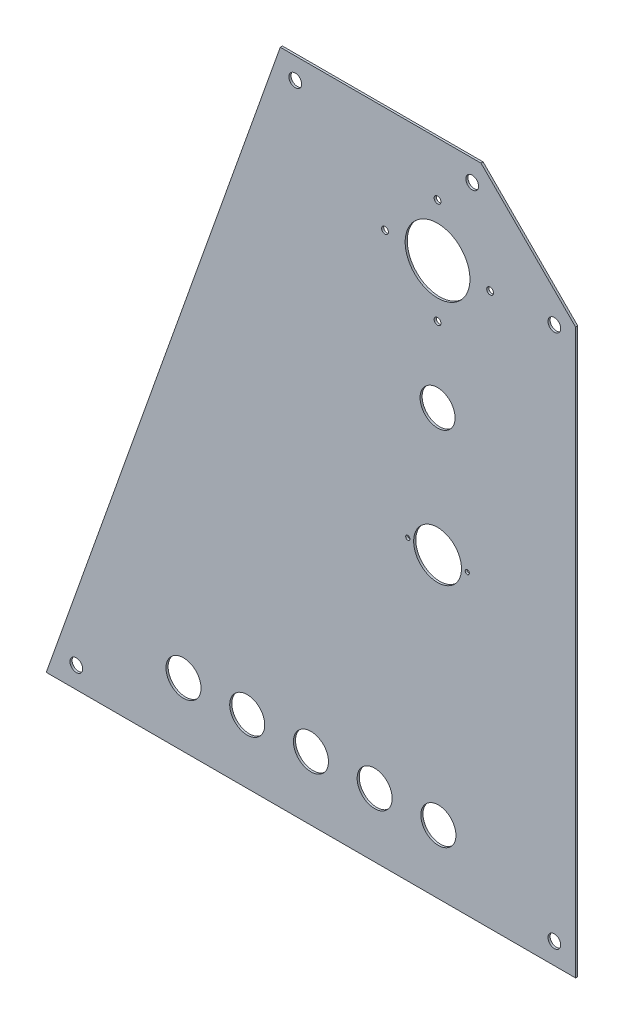
from build123d import *

# Parameters (mm, degrees)
SKETCH1_W           = 310
SKETCH1_H           = 250
BOSS_EXTRUDE1_DEPTH = 1
SKETCH2_OUTSIDE_W   = 391.65
SKETCH2_OUTSIDE_H   = 331.65
CUT_EXTRUDE1_DEPTH  = 200.125588511
SKETCH3_R           = 15.25
SKETCH3_R_2         = 8.25
SKETCH3_R_3         = 11.25
SKETCH3_R_4         = 1.6
SKETCH3_R_5         = 1
CUT_EXTRUDE2_DEPTH  = 200.125588511
SKETCH4_R           = 8.25
CUT_EXTRUDE3_DEPTH  = 200.125588511
SKETCH5_R           = 3
CUT_EXTRUDE4_DEPTH  = 200.125588511


with BuildPart() as part:
    # Sketch1 → Boss-Extrude1 (new body)
    with BuildSketch(Plane(origin=(0, 0, 0), x_dir=(0, 1, 0), z_dir=(0, 0, 1))):
        Rectangle(SKETCH1_W, SKETCH1_H)
    extrude(amount=BOSS_EXTRUDE1_DEPTH)

    # Sketch2 outside → Cut-Extrude1 (cut, through all)
    with BuildSketch(Plane(origin=(0, 0, 1), x_dir=(0, -1, 0), z_dir=(0, 0, 1))):
        Rectangle(SKETCH2_OUTSIDE_W, SKETCH2_OUTSIDE_H)
        Polygon((-155, -14.047727215), (155, -124.233933248), (155, 125), (-110.452272785, 125), (-155, 80.452272785), align=None, mode=Mode.SUBTRACT)
    extrude(amount=-CUT_EXTRUDE1_DEPTH, mode=Mode.SUBTRACT)

    # Sketch3 → Cut-Extrude2 (cut, through all)
    with BuildSketch(Plane(origin=(0, 0, 1), x_dir=(0, -1, 0), z_dir=(0, 0, 1))):
        with Locations(Location((-105, 60, 0), (0, 0, 90))):
            Circle(SKETCH3_R)
        with Locations(Location((-45, 60, 0), (0, 0, 90))):
            Circle(SKETCH3_R_2)
        with Locations(Location((15, 60, 0), (0, 0, 90))):
            Circle(SKETCH3_R_3)
        with Locations(Location((-105, 35.251262658, 0), (0, 0, 90))):
            Circle(SKETCH3_R_4)
        with Locations(Location((-129.748737342, 60, 0), (0, 0, 90))):
            Circle(SKETCH3_R_4)
        with Locations(Location((-105, 84.748737342, 0), (0, 0, 90))):
            Circle(SKETCH3_R_4)
        with Locations(Location((-80.251262658, 60, 0), (0, 0, 90))):
            Circle(SKETCH3_R_4)
        with Locations(Location((15, 74, 0), (0, 0, 90))):
            Circle(SKETCH3_R_5)
        with Locations(Location((15, 46, 0), (0, 0, 90))):
            Circle(SKETCH3_R_5)
    extrude(amount=-CUT_EXTRUDE2_DEPTH, mode=Mode.SUBTRACT)

    # Sketch4 → Cut-Extrude3 (cut, through all)
    with BuildSketch(Plane(origin=(0, 0, 1), x_dir=(0, -1, 0), z_dir=(0, 0, 1))):
        with Locations(Location((125, -59.616966624, 0), (0, 0, 90))):
            Circle(SKETCH4_R)
        with Locations(Location((125, -29.616966624, 0), (0, 0, 90))):
            Circle(SKETCH4_R)
        with Locations(Location((125, 0.383033376, 0), (0, 0, 90))):
            Circle(SKETCH4_R)
        with Locations(Location((125, 30.383033376, 0), (0, 0, 90))):
            Circle(SKETCH4_R)
        with Locations(Location((125, 60.383033376, 0), (0, 0, 90))):
            Circle(SKETCH4_R)
    extrude(amount=-CUT_EXTRUDE3_DEPTH, mode=Mode.SUBTRACT)

    # Sketch5 → Cut-Extrude4 (cut, through all)
    with BuildSketch(Plane(origin=(0, 0, 1), x_dir=(0, -1, 0), z_dir=(0, 0, 1))):
        with Locations(Location((145, -110.066636279, 0), (0, 0, 90))):
            Circle(SKETCH5_R)
        with Locations(Location((-145, -6.989217732, 0), (0, 0, 90))):
            Circle(SKETCH5_R)
        with Locations(Location((-145, 76.310137162, 0), (0, 0, 90))):
            Circle(SKETCH5_R)
        with Locations(Location((145, 115, 0), (0, 0, 90))):
            Circle(SKETCH5_R)
        with Locations(Location((-106.310137162, 115, 0), (0, 0, 90))):
            Circle(SKETCH5_R)
    extrude(amount=-CUT_EXTRUDE4_DEPTH, mode=Mode.SUBTRACT)


solid = part.part
